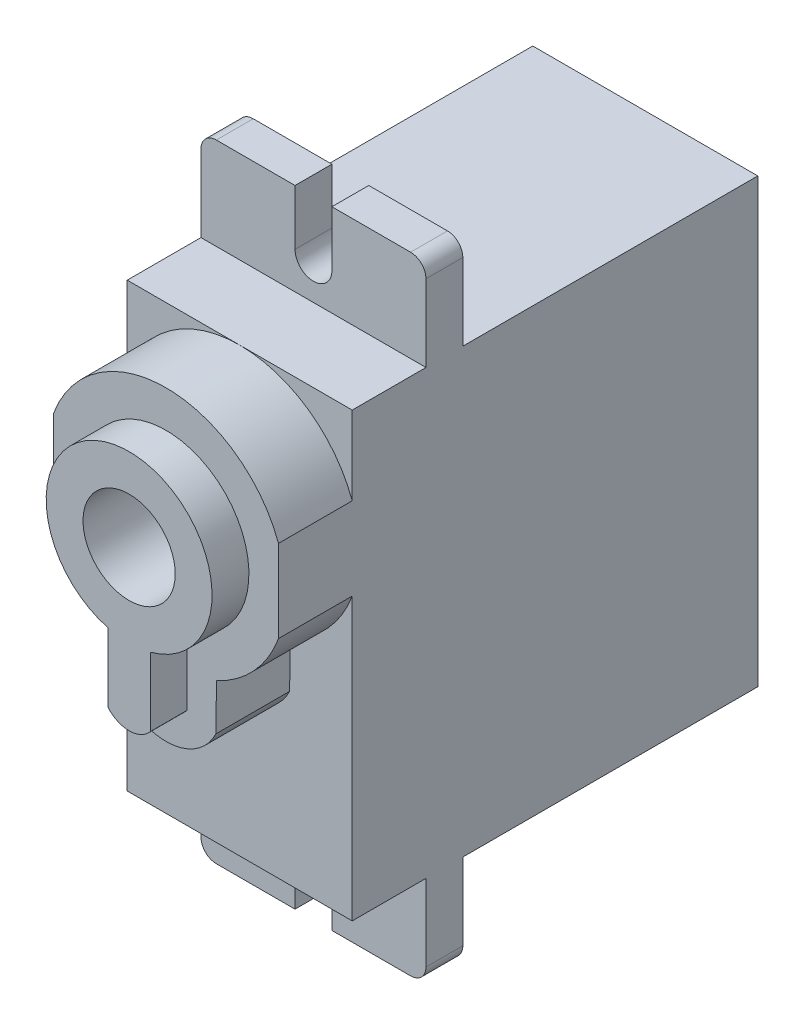
from build123d import *

# Parameters (mm, degrees)
BOSS_EXTRU_2_DEPTH      = 2.4
ESQUISSE3_W             = 14.64741017
ESQUISSE3_H             = 28.8
BOSS_EXTRU_3_DEPTH      = 4.8
BOSS_EXTRU_4_DEPTH      = 4.8
ESQUISSE7_R             = 3
BOSS_EXTRU_5_DEPTH      = 7.2
ENL_V_START             = -4.8
ESQUISSE8_R             = 3
ENL_V_MAT_EXTRU_1_DEPTH = 4.8
ESQUISSE9_W             = 14.64741017
ESQUISSE9_H             = 28.8
BOSS_EXTRU_6_DEPTH      = 19.2
CONG_1_R                = 1


with BuildPart() as part:
    # Esquisse1 → Boss.-Extru.2 (new body)
    with BuildSketch(Plane.XY):
        with BuildLine():
            Line((-7.323705085, 20.4), (-1.2, 20.4))
            Line((-1.2, 20.4), (-1.2, 16.8))
            ThreePointArc((-1.2, 16.8), (0, 15.6), (1.2, 16.8))
            Line((1.2, 16.8), (1.2, 20.4))
            Line((1.2, 20.4), (7.323705085, 20.4))
            Line((7.323705085, 20.4), (7.323705085, -20.4))
            Line((7.323705085, -20.4), (1.2, -20.4))
            Line((1.2, -20.4), (1.2, -16.8))
            ThreePointArc((1.2, -16.8), (0, -15.6), (-1.2, -16.8))
            Line((-1.2, -16.8), (-1.2, -20.4))
            Line((-1.2, -20.4), (-7.323705085, -20.4))
            Line((-7.323705085, -20.4), (-7.323705085, 20.4))
        make_face()
    extrude(amount=BOSS_EXTRU_2_DEPTH)

    # Esquisse3 → Boss.-Extru.3 (add)
    with BuildSketch(Plane.XY.offset(2.4)):
        Rectangle(ESQUISSE3_W, ESQUISSE3_H)
    extrude(amount=BOSS_EXTRU_3_DEPTH)

    # Esquisse4 → Boss.-Extru.4 (add)
    with BuildSketch(Plane.XY.offset(7.2)):
        with BuildLine():
            Line((0, 12), (0, 14.4))
            ThreePointArc((8e-09, 14.4), (-4.466852593, 12.994312153), (-7.323705085, 9.283904587))
            Line((-7.323705085, 9.283904587), (-7.323705085, 3.916095413))
            ThreePointArc((-7.323705085, 3.916095413), (-5.741131727, 1.319904689), (-3.286183333, -0.473966292))
            Line((-3.286183333, -0.473966292), (-3.286183333, -3.414033708))
            ThreePointArc((-3.286183333, -3.414033708), (-1.958044771, -4.964937052), (0, -5.544))
            Line((0, -5.544), (0, -3.744))
            ThreePointArc((0, -3.744), (-0.763253879, -3.574166714), (-1.382478965, -3.096715017))
            Line((-1.382478965, -3.096715017), (-1.382478965, 1.379966292))
            ThreePointArc((-1.382478965, 1.379966292), (-5.354819419, 7.297071724), (0, 12))
        make_face()
        with BuildLine():
            ThreePointArc((7.323705085, 9.283904587), (4.466852599, 12.994312149), (8e-09, 14.4))
            Line((0, 14.4), (0, 12))
            ThreePointArc((0, 12), (5.354819419, 7.297071724), (1.382478965, 1.379966292))
            Line((1.382478965, 1.379966292), (1.382478965, -3.096715017))
            ThreePointArc((1.382478965, -3.096715017), (0.763253879, -3.574166714), (0, -3.744))
            Line((0, -3.744), (0, -5.544))
            ThreePointArc((0, -5.544), (1.920803148, -4.988752086), (3.249094107, -3.49428626))
            Line((3.249094107, -3.49428626), (3.286183333, -0.473966292))
            ThreePointArc((3.286183333, -0.473966292), (5.741131727, 1.319904689), (7.323705085, 3.916095413))
            Line((7.323705085, 3.916095413), (7.323705085, 9.283904587))
        make_face()
    extrude(amount=BOSS_EXTRU_4_DEPTH)

    # Esquisse7 → Boss.-Extru.5 (add)
    with BuildSketch(Plane.XY.offset(7.2)):
        with BuildLine():
            Line((-1.382478965, 1.379966292), (-1.382478965, -3.096715017))
            ThreePointArc((-1.382478965, -3.096715017), (0, -3.744), (1.382478965, -3.096715017))
            Line((1.382478965, -3.096715017), (1.382478965, 1.379966292))
            ThreePointArc((1.382478965, 1.379966292), (0, 12), (-1.382478965, 1.379966292))
        make_face()
        with Locations((0, 6.6)):
            Circle(ESQUISSE7_R, mode=Mode.SUBTRACT)
    extrude(amount=BOSS_EXTRU_5_DEPTH)

    # Esquisse8 → Enlèv. mat.-Extru.1 (cut)
    with BuildSketch(Plane.XY.offset(7.2).offset(ENL_V_START)):
        with Locations((0, 6.6)):
            Circle(ESQUISSE8_R)
    extrude(amount=ENL_V_MAT_EXTRU_1_DEPTH, mode=Mode.SUBTRACT)

    # Esquisse9 → Boss.-Extru.6 (add)
    with BuildSketch(Plane(origin=(0, 0, 0), x_dir=(-1, 0, 0), z_dir=(0, 0, -1))):
        Rectangle(ESQUISSE9_W, ESQUISSE9_H)
    extrude(amount=BOSS_EXTRU_6_DEPTH)

    # Congé1
    cong_1_edges = [part.edges().sort_by_distance(p)[0] for p in [
        (7.323705085, 20.4, 1.2),
        (7.323705085, -20.4, 1.2),
        (-7.323705085, -20.4, 1.2),
        (-7.323705085, 20.4, 1.2),
    ]]
    fillet(cong_1_edges, radius=CONG_1_R)


solid = part.part
